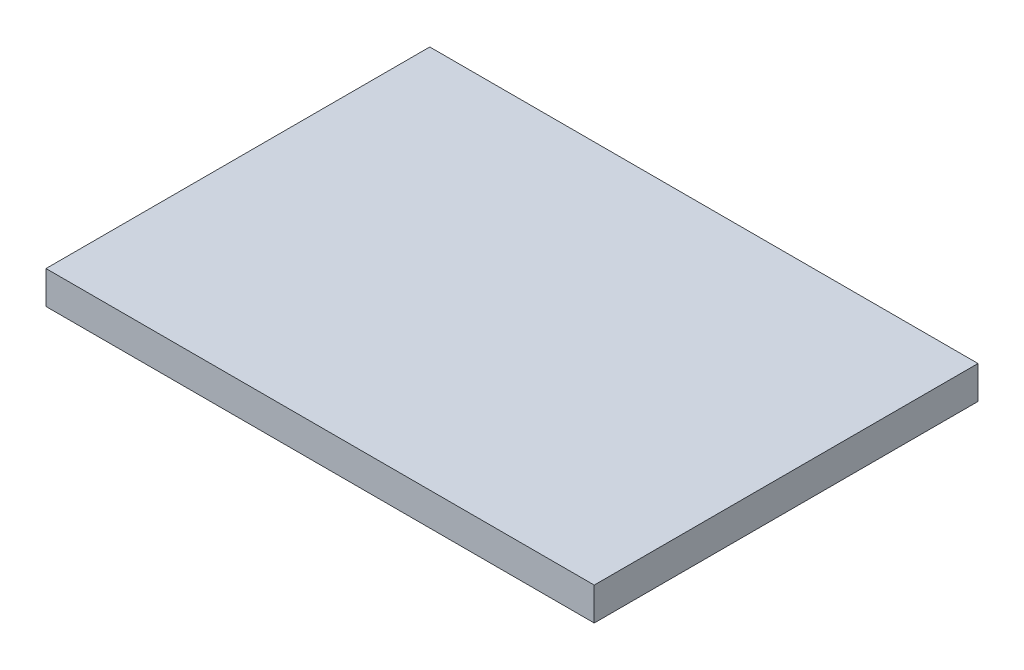
from build123d import *

# Parameters (mm, degrees)
SKETCH1_W           = 50
SKETCH1_H           = 35
BOSS_EXTRUDE1_DEPTH = 1.5


with BuildPart() as part:
    # Sketch1 → Boss-Extrude1 (new, symmetric)
    with BuildSketch(Plane(origin=(0, 0, 0), x_dir=(1, 0, 0), z_dir=(0, 1, 0))):
        Rectangle(SKETCH1_W, SKETCH1_H)
    extrude(amount=BOSS_EXTRUDE1_DEPTH, both=True)


solid = part.part
